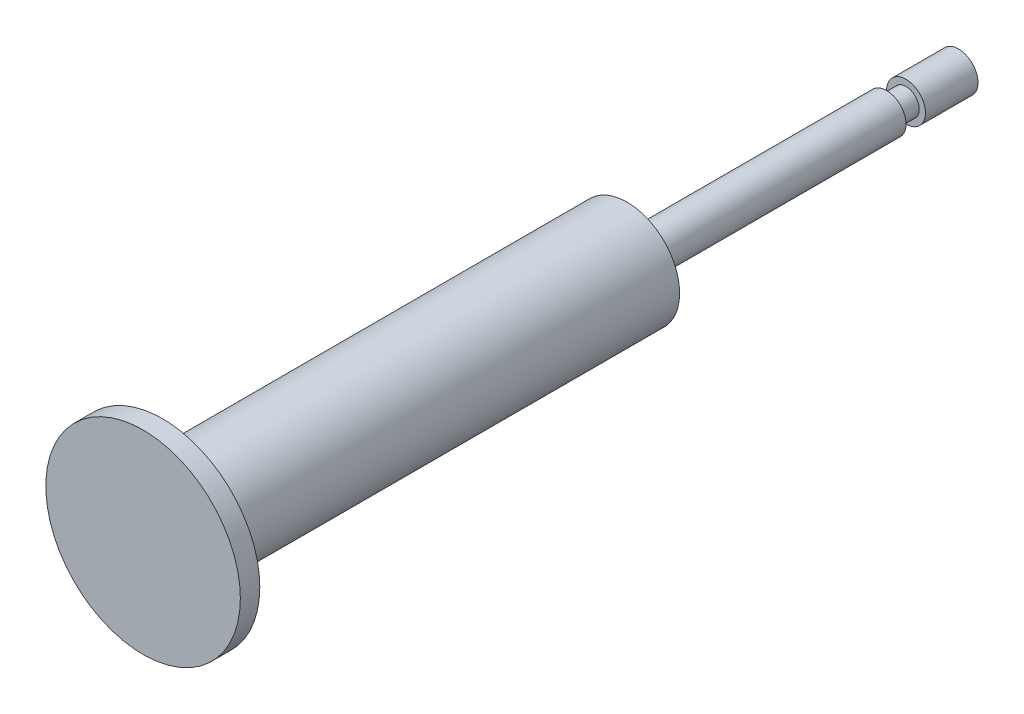
from build123d import *

# Parameters (mm, degrees)
ESBO_O2_R                = 12.5
ESBO_O2_R_2              = 6.75
CORTE_EXTRUS_O1_DEPTH    = 1.5
ESBO_O3_R                = 2.5
RESSALTO_EXTRUS_O1_DEPTH = 104.8
CORTE_EXTRUS_O2_START    = -2.5
ESBO_O4_R                = 2.5
ESBO_O4_R_2              = 1.7
CORTE_EXTRUS_O2_DEPTH    = 2.5


with BuildPart() as part:
    # Esboço1 → Revolução1 (revolve)
    with BuildSketch(Plane(origin=(0, 0, 0), x_dir=(0, 0, -1), z_dir=(1, 0, 0)), mode=Mode.PRIVATE) as revolu_o1_sk:
        Polygon((-44.653738644, 0), (-44.653738644, -12.5), (-40.653738644, -12.5), (-40.653738644, -6.75), (17.546261356, -6.75), (20, -2.5), (0, -2.5), (0, 0), align=None)
    revolve(revolu_o1_sk.sketch.rotate(Axis((0, 0, 72.391069924), (0, 0, -1)), 270), axis=Axis((0, 0, 72.391069924), (0, 0, -1)))

    # Esboço2 → Corte-extrusão1 (cut)
    with BuildSketch(Plane(origin=(0, 0, 40.653738644), x_dir=(-1, 0, 0), z_dir=(0, 0, -1))):
        with Locations(Location((0, 0, 0), (0, 0, 180))):
            Circle(ESBO_O2_R)
        with Locations(Location((0, 0, 0), (0, 0, 180))):
            Circle(ESBO_O2_R_2, mode=Mode.SUBTRACT)
    extrude(amount=-CORTE_EXTRUS_O1_DEPTH, mode=Mode.SUBTRACT)

    # Esboço3 → Ressalto-extrusão1 (add)
    with BuildSketch(Plane.XY.offset(44.653738644)):
        Circle(ESBO_O3_R)
    extrude(amount=-RESSALTO_EXTRUS_O1_DEPTH)

    # Esboço4 → Corte-extrusão2 (cut)
    with BuildSketch(Plane(origin=(0, 0, -53.396261356), x_dir=(-1, 0, 0), z_dir=(0, 0, -1)).offset(CORTE_EXTRUS_O2_START)):
        with Locations(Location((0, 0, 0), (0, 0, 180))):
            Circle(ESBO_O4_R)
        Circle(ESBO_O4_R_2, mode=Mode.SUBTRACT)
    extrude(amount=CORTE_EXTRUS_O2_DEPTH, mode=Mode.SUBTRACT)


solid = part.part
